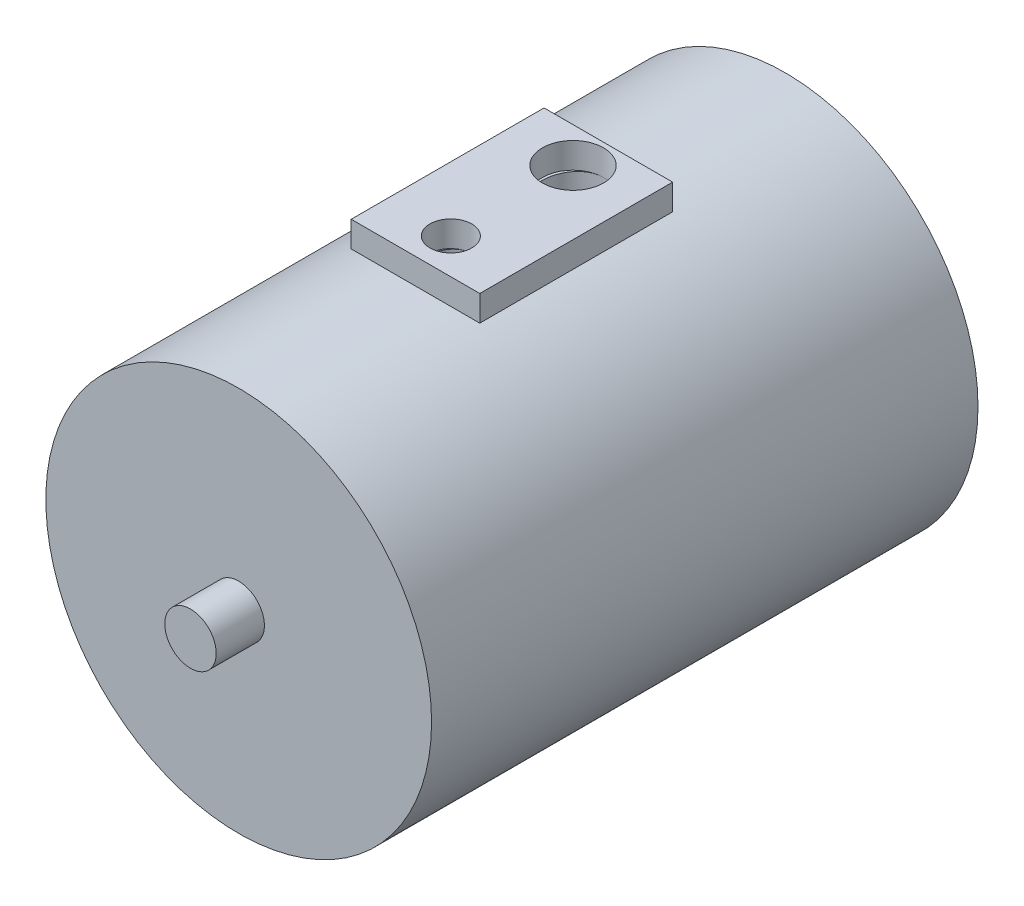
from build123d import *

# Parameters (mm, degrees)
SKETCH1_R           = 60
BOSS_EXTRUDE2_DEPTH = 85
SKETCH2_W           = 40
SKETCH2_H           = 8
BOSS_EXTRUDE3_DEPTH = 30
SKETCH3_R           = 8
BOSS_EXTRUDE4_DEPTH = 15
SKETCH5_R           = 6.5
SKETCH5_R_2         = 9.5
CUT_EXTRUDE1_DEPTH  = 25


with BuildPart() as part:
    # Sketch1 → Boss-Extrude2 (new, symmetric)
    with BuildSketch(Plane.XY):
        Circle(SKETCH1_R)
    extrude(amount=BOSS_EXTRUDE2_DEPTH, both=True)

    # Sketch3 → Boss-Extrude4 (add, symmetric)
    with BuildSketch(Plane.XY.offset(85)):
        Circle(SKETCH3_R)
    extrude(amount=BOSS_EXTRUDE4_DEPTH, both=True)


with BuildPart() as body_2:
    # Sketch2 → Boss-Extrude3 (new, symmetric)
    with BuildSketch(Plane.XY):
        with Locations((0, 64)):
            Rectangle(SKETCH2_W, SKETCH2_H)
    extrude(amount=BOSS_EXTRUDE3_DEPTH, both=True)


with BuildPart() as cut_extrude1_tool:
    # Sketch5 → Cut-Extrude1 (new body)
    with BuildSketch(Plane(origin=(0, 68, 0), x_dir=(1, 0, 0), z_dir=(0, 1, 0))):
        with Locations(Location((0, -19, 0), (0, 0, 270))):
            Circle(SKETCH5_R)
        with Locations(Location((0, 19, 0), (0, 0, 270))):
            Circle(SKETCH5_R_2)
    extrude(amount=-CUT_EXTRUDE1_DEPTH)


with BuildPart() as part_1:
    add(part.part)

    # Cut-Extrude1: cut by cut_extrude1_tool
    add(cut_extrude1_tool.part, mode=Mode.SUBTRACT)


with BuildPart() as body_2_1:
    add(body_2.part)

    # Cut-Extrude1: cut by cut_extrude1_tool
    add(cut_extrude1_tool.part, mode=Mode.SUBTRACT)


solid = Compound([part_1.part, body_2_1.part])
